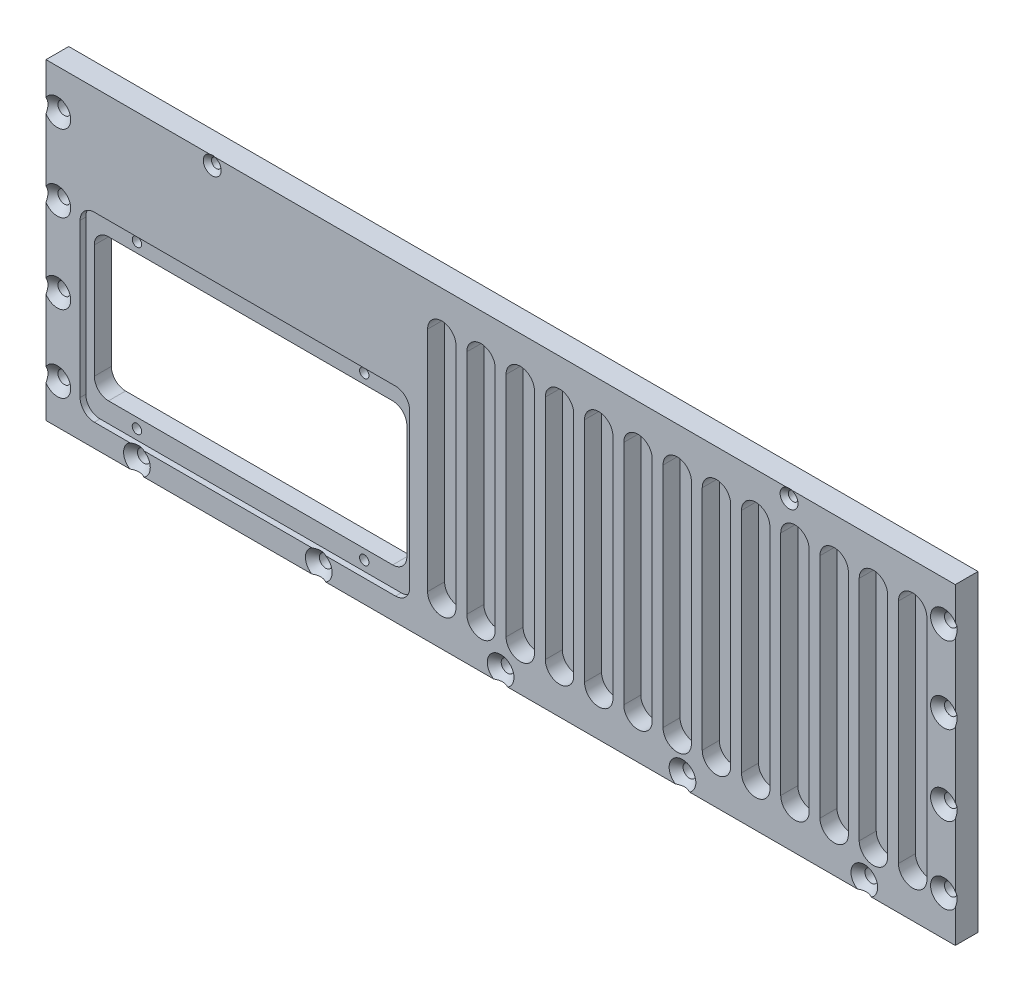
from build123d import *

# Parameters (mm, degrees)
SKETCH1_W                                       = 320
SKETCH1_H                                       = 110
EXTRUDE1_DEPTH                                  = 8
SKETCH2_R                                       = 1.75
CUT_EXTRUDE1_DEPTH                              = 170.378274876
CUT_EXTRUDE2_DEPTH                              = 6
SKETCH7_R                                       = 2.25
CUT_EXTRUDE3_DEPTH                              = 10
SKETCH10_R                                      = 1.5
CUT_EXTRUDE4_DEPTH                              = 10
CSK_FOR_M3_FLAT_HEAD_MACHINE_SCREW3_D           = 3.4
CSK_FOR_M3_FLAT_HEAD_MACHINE_SCREW3_CSINK_D     = 6.3
CSK_FOR_M3_FLAT_HEAD_MACHINE_SCREW3_CSINK_ANGLE = 90
SKETCH13_W                                      = 110
SKETCH13_H                                      = 50
CUT_EXTRUDE5_DEPTH                              = 10
SKETCH14_W                                      = 116
SKETCH14_H                                      = 64
CUT_EXTRUDE6_DEPTH                              = 2
FILLET1_R                                       = 5
SKETCH16_R                                      = 1.65
CUT_EXTRUDE7_DEPTH                              = 10
CSK_FOR_M4_FLAT_HEAD_MACHINE_SCREW1_D           = 4.5
CSK_FOR_M4_FLAT_HEAD_MACHINE_SCREW1_CSINK_D     = 9.4
CSK_FOR_M4_FLAT_HEAD_MACHINE_SCREW1_CSINK_ANGLE = 90


with BuildPart() as part:
    # Sketch1 → Extrude1 (new body)
    with BuildSketch(Plane.XY):
        Rectangle(SKETCH1_W, SKETCH1_H)
    extrude(amount=EXTRUDE1_DEPTH)

    # Sketch2 → Cut-Extrude1 (cut, through all)
    with BuildSketch(Plane.XY.offset(8)):
        with Locations((156, 41)):
            Circle(SKETCH2_R)
        with Locations((156, 14)):
            Circle(SKETCH2_R)
        with Locations(Location((156, -41, 0), (0, 0, 180))):
            Circle(SKETCH2_R)
        with Locations(Location((156, -14, 0), (0, 0, 180))):
            Circle(SKETCH2_R)
        with Locations((-156, -41)):
            Circle(SKETCH2_R)
        with Locations((-156, -14)):
            Circle(SKETCH2_R)
        with Locations(Location((-156, 14, 0), (0, 0, 180))):
            Circle(SKETCH2_R)
        with Locations(Location((-156, 41, 0), (0, 0, 180))):
            Circle(SKETCH2_R)
    extrude(amount=-CUT_EXTRUDE1_DEPTH, mode=Mode.SUBTRACT)

    # Sketch6 → Cut-Extrude2 (cut)
    with BuildSketch(Plane.XY.offset(8)):
        with BuildLine():
            Line((150, 40), (150, -40))
            ThreePointArc((150, -40), (145, -45), (140, -40))
            Line((140, -40), (140, 40))
            ThreePointArc((140, 40), (145, 45), (150, 40))
        make_face()
        with BuildLine():
            Line((136.19047619, 40), (136.19047619, -40))
            ThreePointArc((136.19047619, -40), (131.19047619, -45), (126.19047619, -40))
            Line((126.19047619, -40), (126.19047619, 40))
            ThreePointArc((126.19047619, 40), (131.19047619, 45), (136.19047619, 40))
        make_face()
        with BuildLine():
            Line((122.380952381, 40), (122.380952381, -40))
            ThreePointArc((122.380952381, -40), (117.380952381, -45), (112.380952381, -40))
            Line((112.380952381, -40), (112.380952381, 40))
            ThreePointArc((112.380952381, 40), (117.380952381, 45), (122.380952381, 40))
        make_face()
        with BuildLine():
            Line((108.571428571, 40), (108.571428571, -40))
            ThreePointArc((108.571428571, -40), (103.571428571, -45), (98.571428571, -40))
            Line((98.571428571, -40), (98.571428571, 40))
            ThreePointArc((98.571428571, 40), (103.571428571, 45), (108.571428571, 40))
        make_face()
        with BuildLine():
            Line((94.761904762, 40), (94.761904762, -40))
            ThreePointArc((94.761904762, -40), (89.761904762, -45), (84.761904762, -40))
            Line((84.761904762, -40), (84.761904762, 40))
            ThreePointArc((84.761904762, 40), (89.761904762, 45), (94.761904762, 40))
        make_face()
        with BuildLine():
            Line((80.952380952, 40), (80.952380952, -40))
            ThreePointArc((80.952380952, -40), (75.952380952, -45), (70.952380952, -40))
            Line((70.952380952, -40), (70.952380952, 40))
            ThreePointArc((70.952380952, 40), (75.952380952, 45), (80.952380952, 40))
        make_face()
        with BuildLine():
            Line((67.142857143, 40), (67.142857143, -40))
            ThreePointArc((67.142857143, -40), (62.142857143, -45), (57.142857143, -40))
            Line((57.142857143, -40), (57.142857143, 40))
            ThreePointArc((57.142857143, 40), (62.142857143, 45), (67.142857143, 40))
        make_face()
        with BuildLine():
            Line((53.333333333, 40), (53.333333333, -40))
            ThreePointArc((53.333333333, -40), (48.333333333, -45), (43.333333333, -40))
            Line((43.333333333, -40), (43.333333333, 40))
            ThreePointArc((43.333333333, 40), (48.333333333, 45), (53.333333333, 40))
        make_face()
        with BuildLine():
            Line((39.523809524, 40), (39.523809524, -40))
            ThreePointArc((39.523809524, -40), (34.523809524, -45), (29.523809524, -40))
            Line((29.523809524, -40), (29.523809524, 40))
            ThreePointArc((29.523809524, 40), (34.523809524, 45), (39.523809524, 40))
        make_face()
        with BuildLine():
            Line((25.714285714, 40), (25.714285714, -40))
            ThreePointArc((25.714285714, -40), (20.714285714, -45), (15.714285714, -40))
            Line((15.714285714, -40), (15.714285714, 40))
            ThreePointArc((15.714285714, 40), (20.714285714, 45), (25.714285714, 40))
        make_face()
        with BuildLine():
            Line((11.904761905, 40), (11.904761905, -40))
            ThreePointArc((11.904761905, -40), (6.904761905, -45), (1.904761905, -40))
            Line((1.904761905, -40), (1.904761905, 40))
            ThreePointArc((1.904761905, 40), (6.904761905, 45), (11.904761905, 40))
        make_face()
        with BuildLine():
            Line((-1.904761905, 40), (-1.904761905, -40))
            ThreePointArc((-1.904761905, -40), (-6.904761905, -45), (-11.904761905, -40))
            Line((-11.904761905, -40), (-11.904761905, 40))
            ThreePointArc((-11.904761905, 40), (-6.904761905, 45), (-1.904761905, 40))
        make_face()
        with BuildLine():
            Line((-15.714285714, 40), (-15.714285714, -40))
            ThreePointArc((-15.714285714, -40), (-20.714285714, -45), (-25.714285714, -40))
            Line((-25.714285714, -40), (-25.714285714, 40))
            ThreePointArc((-25.714285714, 40), (-20.714285714, 45), (-15.714285714, 40))
        make_face()
    extrude(amount=-CUT_EXTRUDE2_DEPTH, mode=Mode.SUBTRACT)

    # Sketch7 → Cut-Extrude3 (cut)
    with BuildSketch(Plane.XY.offset(8)):
        with Locations((-64, -51)):
            Circle(SKETCH7_R)
        with Locations((0, -51)):
            Circle(SKETCH7_R)
        with Locations((64, -51)):
            Circle(SKETCH7_R)
        with Locations((-128, -51)):
            Circle(SKETCH7_R)
        with Locations((128, -51)):
            Circle(SKETCH7_R)
    extrude(amount=-CUT_EXTRUDE3_DEPTH, mode=Mode.SUBTRACT)

    # Sketch10 → Cut-Extrude4 (cut)
    with BuildSketch(Plane.XY.offset(8)):
        with Locations((101.5, 52)):
            Circle(SKETCH10_R)
        with Locations((-101.5, 52)):
            Circle(SKETCH10_R)
    extrude(amount=-CUT_EXTRUDE4_DEPTH, mode=Mode.SUBTRACT)

    # CSK for M3 Flat Head Machine Screw3 (through all)
    with Locations(Plane.XY.offset(8)):
        with Locations((-101.5, 52), (101.5, 52)):
            CounterSinkHole(CSK_FOR_M3_FLAT_HEAD_MACHINE_SCREW3_D / 2, CSK_FOR_M3_FLAT_HEAD_MACHINE_SCREW3_CSINK_D / 2, counter_sink_angle=CSK_FOR_M3_FLAT_HEAD_MACHINE_SCREW3_CSINK_ANGLE)

    # Sketch13 → Cut-Extrude5 (cut)
    with BuildSketch(Plane.XY.offset(8)):
        with Locations((-90, -15)):
            Rectangle(SKETCH13_W, SKETCH13_H)
    extrude(amount=-CUT_EXTRUDE5_DEPTH, mode=Mode.SUBTRACT)

    # Sketch14 → Cut-Extrude6 (cut)
    with BuildSketch(Plane.XY.offset(8)):
        with Locations((-90, -15)):
            Rectangle(SKETCH14_W, SKETCH14_H)
    extrude(amount=-CUT_EXTRUDE6_DEPTH, mode=Mode.SUBTRACT)

    # Fillet1
    fillet1_edges = [part.edges().sort_by_distance(p)[0] for p in [
        (-145, -40, 3),
        (-145, 10, 3),
        (-35, 10, 3),
        (-35, -40, 3),
        (-148, -47, 7),
        (-148, 17, 7),
        (-32, 17, 7),
        (-32, -47, 7),
    ]]
    fillet(fillet1_edges, radius=FILLET1_R)

    # Sketch16 → Cut-Extrude7 (cut)
    with BuildSketch(Plane.XY.offset(6)):
        with Locations((-130, -43.5)):
            Circle(SKETCH16_R)
        with Locations((-50, -43.5)):
            Circle(SKETCH16_R)
        with Locations((-50, 13.5)):
            Circle(SKETCH16_R)
        with Locations((-130, 13.5)):
            Circle(SKETCH16_R)
    extrude(amount=-CUT_EXTRUDE7_DEPTH, mode=Mode.SUBTRACT)

    # CSK for M4 Flat Head Machine Screw1 (through all)
    with Locations(Plane.XY.offset(8)):
        with Locations((156, 41), (156, 14), (156, -41), (-156, -41), (-156, -14), (-156, 14), (-156, 41), (156, -14), (-128, -51), (-64, -51), (0, -51), (64, -51), (128, -51)):
            CounterSinkHole(CSK_FOR_M4_FLAT_HEAD_MACHINE_SCREW1_D / 2, CSK_FOR_M4_FLAT_HEAD_MACHINE_SCREW1_CSINK_D / 2, counter_sink_angle=CSK_FOR_M4_FLAT_HEAD_MACHINE_SCREW1_CSINK_ANGLE)


solid = part.part
